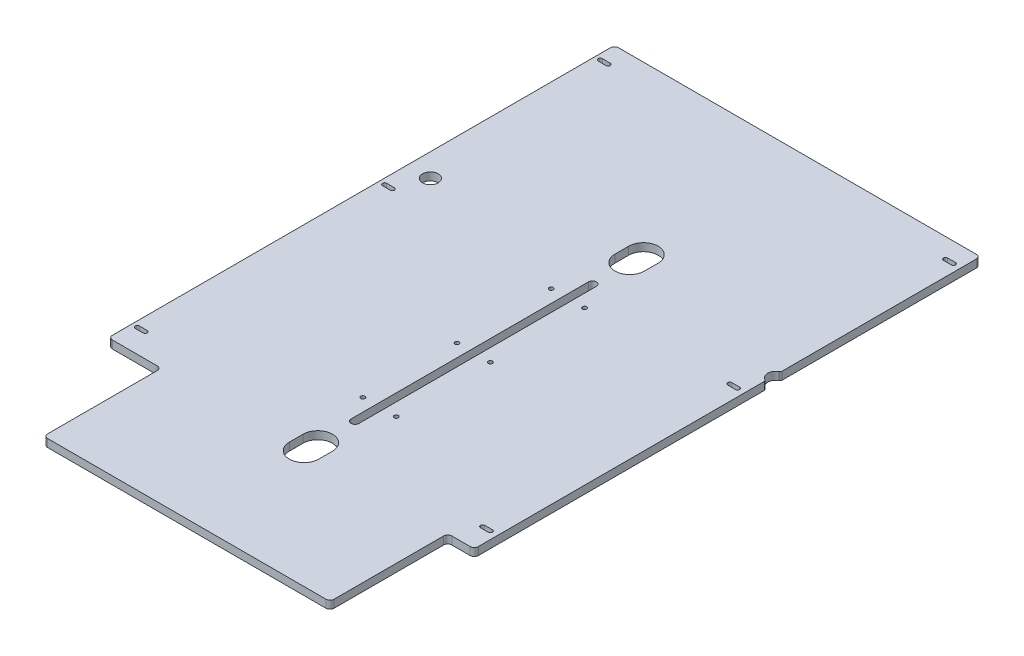
from build123d import *

# Parameters (mm, degrees)
BOSS_EXTRUDE1_DEPTH = 12.7
FILLET1_R           = 6.604
FILLET2_R           = 6.604
SKETCH2_R           = 12.7
CUT_EXTRUDE1_DEPTH  = 1020.273904858
CUT_EXTRUDE3_DEPTH  = 1020.273904858
CUT_EXTRUDE4_DEPTH  = 1020.273904858
SKETCH6_R           = 3.3782
CUT_EXTRUDE5_DEPTH  = 1020.273904858
CUT_EXTRUDE6_DEPTH  = 1020.273904858
CUT_EXTRUDE7_DEPTH  = 1019.820731075
FILLET3_R           = 3.175


with BuildPart() as part:
    # Sketch1 → Boss-Extrude1 (new body)
    with BuildSketch(Plane(origin=(0, 0, 0), x_dir=(1, 0, 0), z_dir=(0, 1, 0))):
        Polygon((0, 0), (96.04375, 0), (96.04375, -190.5), (559.59375, -190.5), (559.59375, 0), (606.425, 0), (606.425, 819.15), (0, 819.15), align=None)
        with BuildLine():
            Line((19.05, 41.4782), (31.75, 41.4782))
            ThreePointArc((31.75, 41.4782), (35.1282, 38.1), (31.75, 34.7218))
            Line((31.75, 34.7218), (19.05, 34.7218))
            ThreePointArc((19.05, 34.7218), (15.6718, 38.1), (19.05, 41.4782))
        make_face(mode=Mode.SUBTRACT)
        with BuildLine():
            Line((19.05, 441.5282), (31.75, 441.5282))
            ThreePointArc((31.75, 441.5282), (35.1282, 438.15), (31.75, 434.7718))
            Line((31.75, 434.7718), (19.05, 434.7718))
            ThreePointArc((19.05, 434.7718), (15.6718, 438.15), (19.05, 441.5282))
        make_face(mode=Mode.SUBTRACT)
        with BuildLine():
            Line((31.75, 784.0218), (19.05, 784.0218))
            ThreePointArc((19.05, 784.0218), (15.6718, 787.4), (19.05, 790.7782))
            Line((19.05, 790.7782), (31.75, 790.7782))
            ThreePointArc((31.75, 790.7782), (35.1282, 787.4), (31.75, 784.0218))
        make_face(mode=Mode.SUBTRACT)
        with BuildLine():
            Line((577.85, 784.0218), (590.55, 784.0218))
            ThreePointArc((590.55, 784.0218), (593.9282, 787.4), (590.55, 790.7782))
            Line((590.55, 790.7782), (577.85, 790.7782))
            ThreePointArc((577.85, 790.7782), (574.4718, 787.4), (577.85, 784.0218))
        make_face(mode=Mode.SUBTRACT)
        with BuildLine():
            Line((590.55, 441.5282), (577.85, 441.5282))
            ThreePointArc((577.85, 441.5282), (574.4718, 438.15), (577.85, 434.7718))
            Line((577.85, 434.7718), (590.55, 434.7718))
            ThreePointArc((590.55, 434.7718), (593.9282, 438.15), (590.55, 441.5282))
        make_face(mode=Mode.SUBTRACT)
        with BuildLine():
            Line((590.55, 41.4782), (577.85, 41.4782))
            ThreePointArc((577.85, 41.4782), (574.4718, 38.1), (577.85, 34.7218))
            Line((577.85, 34.7218), (590.55, 34.7218))
            ThreePointArc((590.55, 34.7218), (593.9282, 38.1), (590.55, 41.4782))
        make_face(mode=Mode.SUBTRACT)
    extrude(amount=BOSS_EXTRUDE1_DEPTH)

    # Fillet1
    fillet1_edges = [part.edges().sort_by_distance(p)[0] for p in [
        (559.59375, 6.35, 0),
        (96.04375, 6.35, 0),
    ]]
    fillet(fillet1_edges, radius=FILLET1_R)

    # Fillet2
    fillet2_edges = [part.edges().sort_by_distance(p)[0] for p in [
        (0, 6.35, -819.15),
        (606.425, 6.35, -819.15),
        (606.425, 6.35, 0),
        (559.59375, 6.35, 190.5),
        (96.04375, 6.35, 190.5),
        (0, 6.35, 0),
    ]]
    fillet(fillet2_edges, radius=FILLET2_R)

    # Sketch2 → Cut-Extrude1 (cut, through all)
    with BuildSketch(Plane(origin=(0, 12.7, 0), x_dir=(1, 0, 0), z_dir=(0, 1, 0))):
        with Locations(Location((47.625, 483.87, 0), (0, 0, 270))):
            Circle(SKETCH2_R)
        with BuildLine():
            Line((606.425, 505.867045256), (606.425, 461.872954744))
            ThreePointArc((606.425, 461.872954744), (604.723522628, 468.222954744), (600.075, 472.871477372))
            ThreePointArc((600.075, 472.871477372), (593.725, 483.87), (600.075, 494.868522628))
            ThreePointArc((600.075, 494.868522628), (604.723522628, 499.517045256), (606.425, 505.867045256))
        make_face()
    extrude(amount=-CUT_EXTRUDE1_DEPTH, mode=Mode.SUBTRACT)

    # Sketch4 → Cut-Extrude3 (cut, through all)
    with BuildSketch(Plane.XZ):
        with BuildLine():
            Line((350.8375, -527.05), (350.8375, -549.275))
            ThreePointArc((350.8375, -549.275), (327.025, -573.0875), (303.2125, -549.275))
            Line((303.2125, -549.275), (303.2125, -527.05))
            ThreePointArc((303.2125, -527.05), (327.025, -503.2375), (350.8375, -527.05))
        make_face()
        with BuildLine():
            Line((350.8375, 0), (350.8375, -22.225))
            ThreePointArc((350.8375, -22.225), (327.025, -46.0375), (303.2125, -22.225))
            Line((303.2125, -22.225), (303.2125, 0))
            ThreePointArc((303.2125, 0), (327.025, 23.8125), (350.8375, 0))
        make_face()
    extrude(amount=-CUT_EXTRUDE3_DEPTH, mode=Mode.SUBTRACT)

    # Sketch5 → Cut-Extrude4 (cut, through all)
    with BuildSketch(Plane.XZ):
        with BuildLine():
            Line((320.675, -466.725), (320.675, -82.55))
            ThreePointArc((320.675, -82.55), (327.025, -76.2), (333.375, -82.55))
            Line((333.375, -82.55), (333.375, -466.725))
            ThreePointArc((333.375, -466.725), (327.025, -473.075), (320.675, -466.725))
        make_face()
    extrude(amount=-CUT_EXTRUDE4_DEPTH, mode=Mode.SUBTRACT)

    # Sketch6 → Cut-Extrude5 (cut, through all)
    with BuildSketch(Plane.XZ):
        with Locations(Location((354.0125, -274.6375, 0), (0, 0, 270))):
            Circle(SKETCH6_R)
        with Locations(Location((354.0125, -427.0375, 0), (0, 0, 270))):
            Circle(SKETCH6_R)
        with Locations(Location((354.0125, -122.2375, 0), (0, 0, 90))):
            Circle(SKETCH6_R)
        with Locations(Location((300.0375, -427.0375, 0), (0, 0, 90))):
            Circle(SKETCH6_R)
        with Locations(Location((300.0375, -274.6375, 0), (0, 0, 90))):
            Circle(SKETCH6_R)
        with Locations(Location((300.0375, -122.2375, 0), (0, 0, 270))):
            Circle(SKETCH6_R)
    extrude(amount=-CUT_EXTRUDE5_DEPTH, mode=Mode.SUBTRACT)

    # Sketch7 → Cut-Extrude6 (cut, through all)
    with BuildSketch(Plane.XZ):
        with BuildLine():
            ThreePointArc((605.663, -812.546), (603.728733183, -817.215733183), (599.059, -819.15))
            Line((599.059, -819.15), (599.821, -819.15))
            ThreePointArc((599.821, -819.15), (604.490733183, -817.215733183), (606.425, -812.546))
            Line((606.425, -812.546), (606.425, -505.867045256))
            ThreePointArc((606.425, -505.867045256), (604.723522628, -499.517045256), (600.075, -494.868522628))
            ThreePointArc((600.075, -494.868522628), (604.165699913, -498.959222541), (605.663, -504.547222541))
            Line((605.663, -504.547222541), (605.663, -812.546))
        make_face()
        with BuildLine():
            ThreePointArc((0.762, -812.546), (2.696266817, -817.215733183), (7.366, -819.15))
            Line((7.366, -819.15), (6.604, -819.15))
            ThreePointArc((6.604, -819.15), (1.934266817, -817.215733183), (0, -812.546))
            Line((0, -812.546), (0, -6.604))
            ThreePointArc((0, -6.604), (1.934266817, -1.934266817), (6.604, 0))
            Line((6.604, 0), (7.366, 0))
            ThreePointArc((7.366, 0), (2.696266817, -1.934266817), (0.762, -6.604))
            Line((0.762, -6.604), (0.762, -812.546))
        make_face()
        with BuildLine():
            ThreePointArc((605.663, -462.330859906), (604.07096336, -468.487413325), (599.694, -473.100429953))
            ThreePointArc((599.694, -473.100429953), (599.883498256, -472.98428666), (600.075, -472.871477372))
            ThreePointArc((600.075, -472.871477372), (604.723522628, -468.222954744), (606.425, -461.872954744))
            Line((606.425, -461.872954744), (606.425, -6.604))
            ThreePointArc((606.425, -6.604), (604.490733183, -1.934266817), (599.821, 0))
            Line((599.821, 0), (599.059, 0))
            ThreePointArc((599.059, 0), (603.728733183, -1.934266817), (605.663, -6.604))
            Line((605.663, -6.604), (605.663, -462.330859906))
        make_face()
    extrude(amount=-CUT_EXTRUDE6_DEPTH, mode=Mode.SUBTRACT)

    # Sketch8 → Cut-Extrude7 (cut, through all)
    with BuildSketch(Plane.XZ):
        with BuildLine():
            ThreePointArc((595.884, -819.15), (600.553733183, -817.215733183), (602.488, -812.546))
            Line((602.488, -812.546), (602.488, -6.604))
            ThreePointArc((602.488, -6.604), (600.553733183, -1.934266817), (595.884, 0))
            Line((595.884, 0), (599.059, 0))
            ThreePointArc((599.059, 0), (603.728733183, -1.934266817), (605.663, -6.604))
            Line((605.663, -6.604), (605.663, -812.546))
            ThreePointArc((605.663, -812.546), (603.728733183, -817.215733183), (599.059, -819.15))
            Line((599.059, -819.15), (595.884, -819.15))
        make_face()
        with BuildLine():
            Line((0.762, -6.604), (0.762, -812.546))
            ThreePointArc((0.762, -812.546), (2.696266817, -817.215733183), (7.366, -819.15))
            Line((7.366, -819.15), (16.891, -819.15))
            ThreePointArc((16.891, -819.15), (12.221266817, -817.215733183), (10.287, -812.546))
            Line((10.287, -812.546), (10.287, -6.604))
            ThreePointArc((10.287, -6.604), (12.221266817, -1.934266817), (16.891, 0))
            Line((16.891, 0), (7.366, 0))
            ThreePointArc((7.366, 0), (2.696266817, -1.934266817), (0.762, -6.604))
        make_face()
    extrude(amount=-CUT_EXTRUDE7_DEPTH, mode=Mode.SUBTRACT)

    # Fillet3
    fillet3_edges = [part.edges().sort_by_distance(p)[0] for p in [
        (602.488, 6.35, -470.731120318),
        (602.488, 6.35, -496.744211904),
    ]]
    fillet(fillet3_edges, radius=FILLET3_R)


solid = part.part
